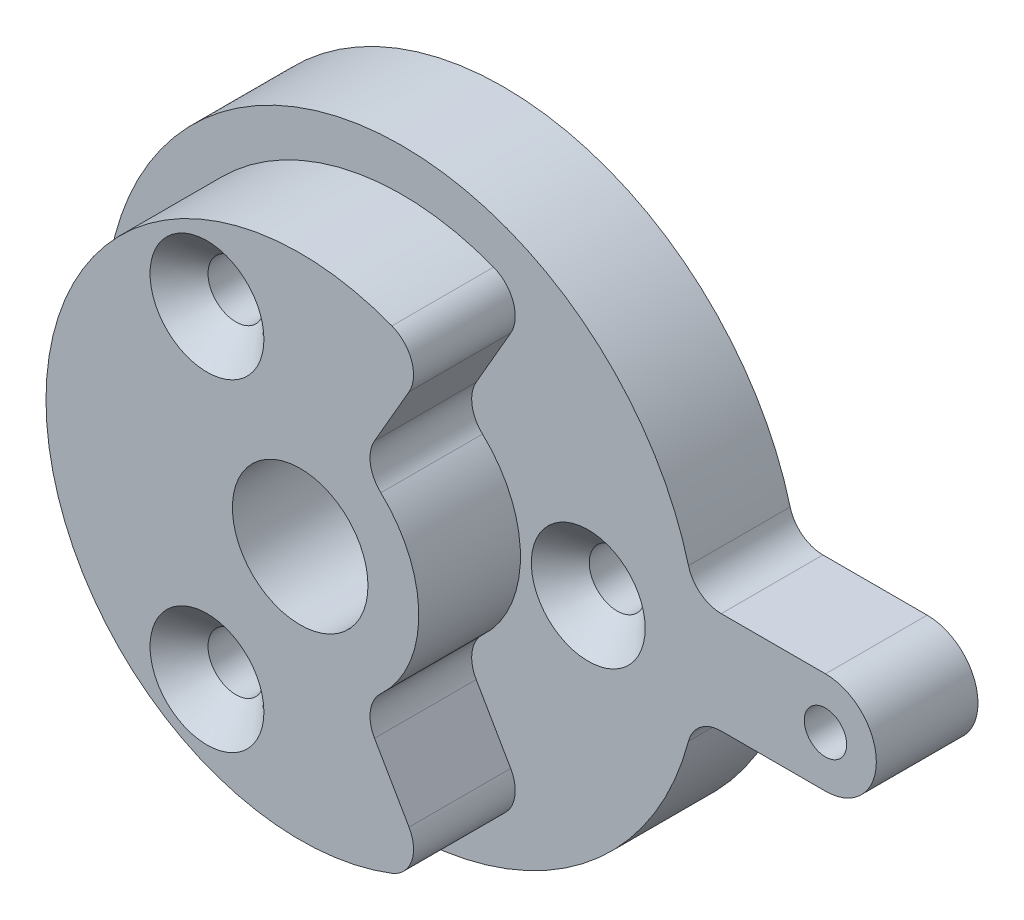
from build123d import *

# Parameters (mm, degrees)
SKETCH1_R                                            = 35
SKETCH1_R_2                                          = 8
BOSS_EXTRUDE1_DEPTH                                  = 12
SKETCH2_R                                            = 8
BOSS_EXTRUDE2_DEPTH                                  = 12
BOSS_EXTRUDE3_DEPTH                                  = 12
FILLET1_R                                            = 4
M6_TAPPED_HOLE1_D                                    = 5
CSK_FOR_M6_HEX_SOCKET_COUNTERSUNK_CAP_SC_D           = 6.6
CSK_FOR_M6_HEX_SOCKET_COUNTERSUNK_CAP_SC_CSINK_D     = 13.44
CSK_FOR_M6_HEX_SOCKET_COUNTERSUNK_CAP_SC_CSINK_ANGLE = 90
CSK_FOR_M6_HEX_SOCKET_COUNTERSUNK_CA_2_D             = 6.6
CSK_FOR_M6_HEX_SOCKET_COUNTERSUNK_CA_2_CSINK_D       = 13.44
CSK_FOR_M6_HEX_SOCKET_COUNTERSUNK_CA_2_CSINK_ANGLE   = 90


with BuildPart() as part:
    # Sketch1 → Boss-Extrude1 (new body)
    with BuildSketch(Plane.XY):
        Circle(SKETCH1_R)
        Circle(SKETCH1_R_2, mode=Mode.SUBTRACT)
    extrude(amount=BOSS_EXTRUDE1_DEPTH)

    # Sketch2 → Boss-Extrude2 (add)
    with BuildSketch(Plane.XY.offset(12)):
        with BuildLine():
            Line((15, 25.980762114), (7, 12.124355653))
            ThreePointArc((7, 12.124355653), (14, 0), (7, -12.124355653))
            Line((7, -12.124355653), (15, -25.980762114))
            ThreePointArc((15, -25.980762114), (-30, 0), (15, 25.980762114))
        make_face()
        Circle(SKETCH2_R, mode=Mode.SUBTRACT)
    extrude(amount=BOSS_EXTRUDE2_DEPTH)

    # Sketch5 → Boss-Extrude3 (add)
    with BuildSketch(Plane.XY.offset(12)):
        with BuildLine():
            Line((50, -6), (14, -6))
            ThreePointArc((14, -6), (8, 0), (14, 6))
            Line((14, 6), (50, 6))
            ThreePointArc((50, 6), (56, 0), (50, -6))
        make_face()
    extrude(amount=-BOSS_EXTRUDE3_DEPTH)

    # Fillet1
    fillet1_edges = [part.edges().sort_by_distance(p)[0] for p in [
        (7, -12.124355653, 18),
        (7, 12.124355653, 18),
        (15, 25.980762114, 18),
        (15, -25.980762114, 18),
        (34.481879299, 6, 6),
        (34.481879299, -6, 6),
    ]]
    fillet(fillet1_edges, radius=FILLET1_R)

    # M6 Tapped Hole1 (through all)
    with Locations(Plane.XY.offset(12)):
        with Locations((50, 0)):
            Hole(M6_TAPPED_HOLE1_D / 2)

    # CSK for M6 Hex Socket Countersunk Cap Screw1 (through all)
    with Locations(Plane(origin=(-11, 19.052558883, 24), x_dir=(1, 0, 0), z_dir=(0, 0, 1))):
        with Locations((0, 0), (0, -38.105117766)):
            CounterSinkHole(CSK_FOR_M6_HEX_SOCKET_COUNTERSUNK_CAP_SC_D / 2, CSK_FOR_M6_HEX_SOCKET_COUNTERSUNK_CAP_SC_CSINK_D / 2, counter_sink_angle=CSK_FOR_M6_HEX_SOCKET_COUNTERSUNK_CAP_SC_CSINK_ANGLE)

    # CSK for M6 Hex Socket Countersunk Ca 2 (through all)
    with Locations(Plane(origin=(22, 0, 12), x_dir=(1, 0, 0), z_dir=(0, 0, 1))):
        with Locations((0, 0)):
            CounterSinkHole(CSK_FOR_M6_HEX_SOCKET_COUNTERSUNK_CA_2_D / 2, CSK_FOR_M6_HEX_SOCKET_COUNTERSUNK_CA_2_CSINK_D / 2, counter_sink_angle=CSK_FOR_M6_HEX_SOCKET_COUNTERSUNK_CA_2_CSINK_ANGLE)


solid = part.part
